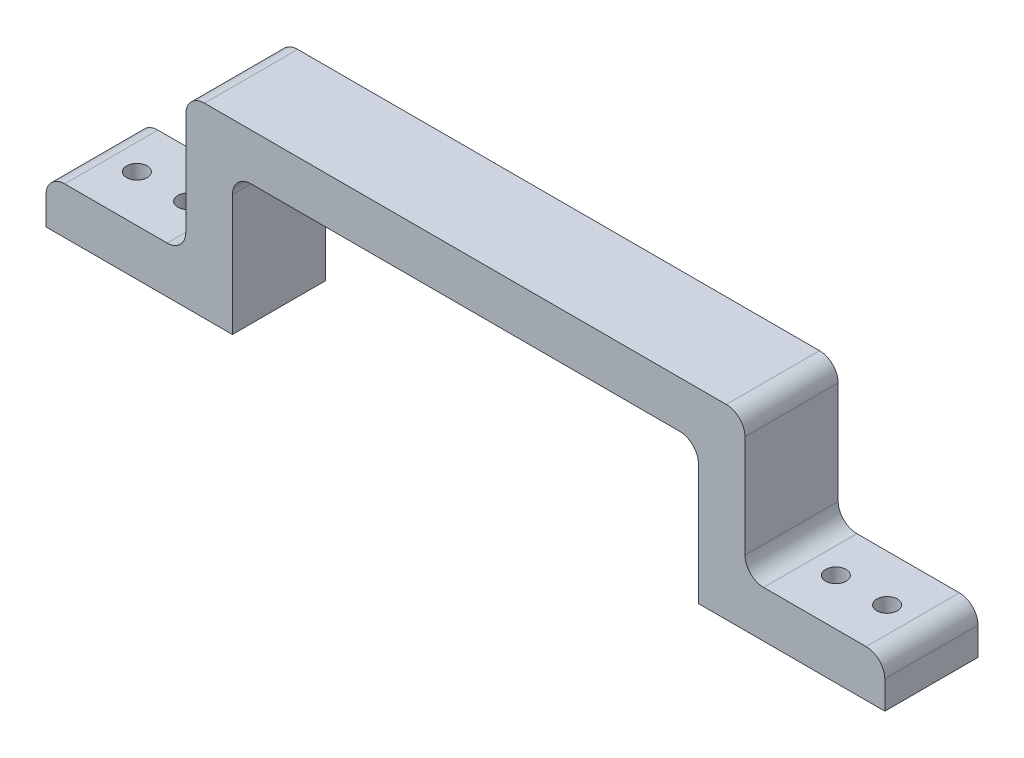
from build123d import *

# Parameters (mm, degrees)
EXTRUDE_1_DEPTH     = 20
SKETCH_2_R          = 2.2
CUT_EXTRUDE_1_DEPTH = 20


with BuildPart() as part:
    # 草图1 → 凸台-拉伸1 (new body)
    with BuildSketch(Plane.XY):
        with BuildLine():
            Line((-46, 30), (46, 30))
            ThreePointArc((46, 30), (48.828427125, 28.828427125), (50, 26))
            Line((50, 26), (50, 0))
            Line((50, 0), (90, 0))
            Line((90, 0), (90, 6))
            ThreePointArc((90, 6), (88.828427125, 8.828427125), (86, 10))
            Line((86, 10), (64, 10))
            ThreePointArc((64, 10), (61.171572875, 11.171572875), (60, 14))
            Line((60, 14), (60, 36))
            ThreePointArc((60, 36), (58.828427125, 38.828427125), (56, 40))
            Line((56, 40), (-56, 40))
            ThreePointArc((-56, 40), (-58.828427125, 38.828427125), (-60, 36))
            Line((-60, 36), (-60, 14))
            ThreePointArc((-60, 14), (-61.171572875, 11.171572875), (-64, 10))
            Line((-64, 10), (-86, 10))
            ThreePointArc((-86, 10), (-88.828427125, 8.828427125), (-90, 6))
            Line((-90, 6), (-90, 0))
            Line((-90, 0), (-50, 0))
            Line((-50, 0), (-50, 26))
            ThreePointArc((-50, 26), (-48.828427125, 28.828427125), (-46, 30))
        make_face()
    extrude(amount=EXTRUDE_1_DEPTH)

    # 草图2 → 切除-拉伸1 (cut)
    with BuildSketch(Plane(origin=(0, 10, 0), x_dir=(1, 0, 0), z_dir=(0, 1, 0))):
        with Locations(Location((-80.5, -10, 0), (0, 0, 270))):
            Circle(SKETCH_2_R)
        with Locations(Location((-69.5, -10, 0), (0, 0, 270))):
            Circle(SKETCH_2_R)
        with Locations(Location((69.5, -10, 0), (0, 0, 270))):
            Circle(SKETCH_2_R)
        with Locations(Location((80.5, -10, 0), (0, 0, 270))):
            Circle(SKETCH_2_R)
    extrude(amount=-CUT_EXTRUDE_1_DEPTH, mode=Mode.SUBTRACT)


solid = part.part
